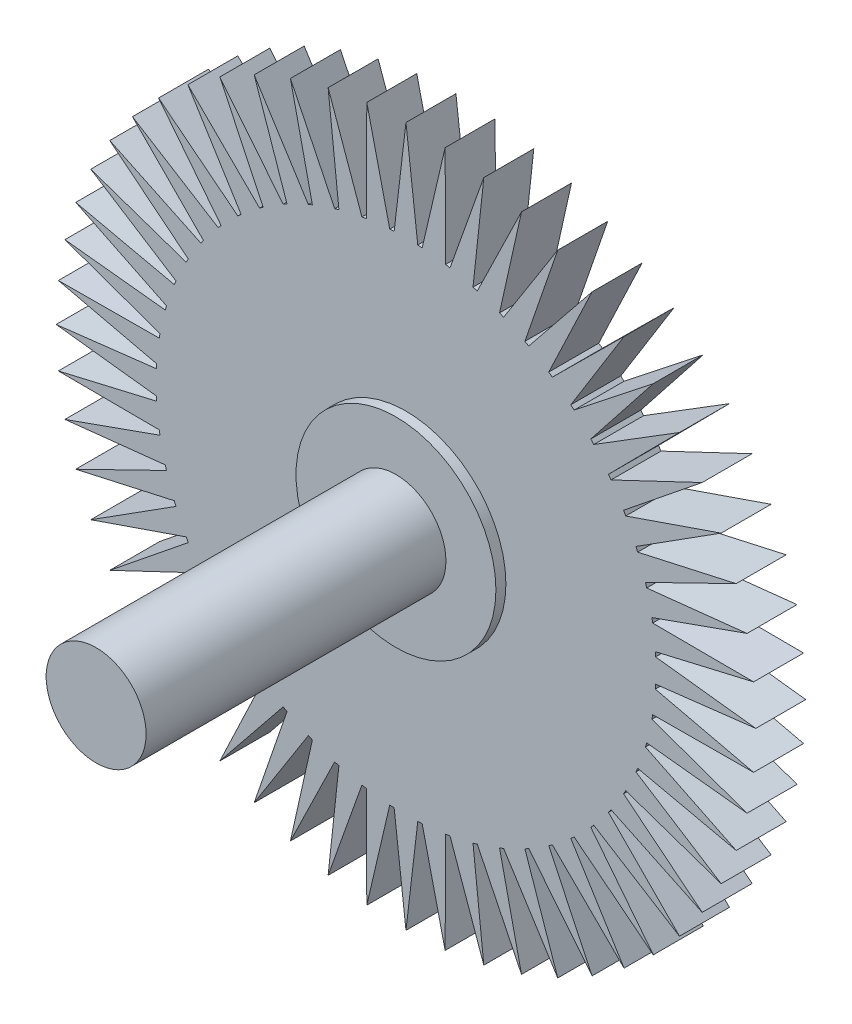
from build123d import *

# Parameters (mm, degrees)
ESQUISSE1_R             = 35
BOSS_EXTRU_1_DEPTH      = 5
ENL_V_START             = -5
ENL_V_MAT_EXTRU_2_DEPTH = 5
ESQUISSE5_R             = 10
BOSS_EXTRU_2_DEPTH      = 1
ESQUISSE6_R             = 5
BOSS_EXTRU_3_DEPTH      = 30


with BuildPart() as part:
    # Esquisse1 → Boss.-Extru.1 (new body)
    with BuildSketch(Plane.XY):
        Circle(ESQUISSE1_R)
    extrude(amount=BOSS_EXTRU_1_DEPTH)

    # Esquisse3 → Enlèv. mat.-Extru.2 (cut)
    with BuildSketch(Plane.XY.offset(5).offset(ENL_V_START)):
        with BuildLine():
            Line((-11.898891299, 21.986732041), (-15.185930869, 31.533910377))
            ThreePointArc((-15.185930869, 31.533910377), (-16.930161049, 30.632819767), (-18.621122678, 29.635346973))
            Line((-18.621122678, 29.635346973), (-12.286106235, 21.77272591))
            ThreePointArc((-12.286106235, 21.77272591), (-12.092972178, 21.880585548), (-11.898891299, 21.986732041))
        make_face()
        with BuildLine():
            Line((-9.362340634, 23.180737216), (-11.559767168, 33.035916561))
            ThreePointArc((-11.559767168, 33.035916561), (-13.393920133, 32.335783638), (-15.185930869, 31.533910377))
            Line((-15.185930869, 31.533910377), (-9.771081928, 23.011431028))
            ThreePointArc((-9.771081928, 23.011431028), (-9.567085809, 23.096988313), (-9.362340634, 23.180737216))
        make_face()
        with BuildLine():
            Line((-6.708053103, 24.08323117), (-7.788232688, 34.122476926))
            ThreePointArc((-7.788232688, 34.122476926), (-9.6892429, 33.632106268), (-11.559767168, 33.035916561))
            Line((-11.559767168, 33.035916561), (-7.133180597, 23.960754049))
            ThreePointArc((-7.133180597, 23.960754049), (-6.920887786, 24.022933049), (-6.708053103, 24.08323117))
        make_face()
        with BuildLine():
            Line((-3.969407912, 24.682864518), (-3.918756664, 34.779927346))
            ThreePointArc((-3.918756664, 34.779927346), (-5.862717816, 34.505485648), (-7.788232688, 34.122476926))
            Line((-7.788232688, 34.122476926), (-4.40557538, 24.608756685))
            ThreePointArc((-4.40557538, 24.608756685), (-4.187655583, 24.646775463), (-3.969407912, 24.682864518))
        make_face()
        with BuildLine():
            Line((-1.180845114, 24.972096524), (0, 35))
            ThreePointArc((0, 35), (-1.962465653, 34.944938526), (-3.918756664, 34.779927346))
            Line((-3.918756664, 34.779927346), (-1.622567497, 24.947289927))
            ThreePointArc((-1.622567497, 24.947289927), (-1.401761181, 24.960670375), (-1.180845114, 24.972096524))
        make_face()
        with BuildLine():
            ThreePointArc((3.918756664, 34.779927346), (1.962465653, 34.944938526), (0, 35))
            Line((0, 35), (1.180845114, 24.972096524))
            ThreePointArc((1.180845114, 24.972096524), (1.401761181, 24.960670375), (1.622567497, 24.947289927))
            Line((1.622567497, 24.947289927), (3.918756664, 34.779927346))
        make_face()
        with BuildLine():
            ThreePointArc((7.788232688, 34.122476926), (5.862717816, 34.505485648), (3.918756664, 34.779927346))
            Line((3.918756664, 34.779927346), (3.969407912, 24.682864518))
            ThreePointArc((3.969407912, 24.682864518), (4.187655583, 24.646775463), (4.40557538, 24.608756685))
            Line((4.40557538, 24.608756685), (7.788232688, 34.122476926))
        make_face()
        with BuildLine():
            ThreePointArc((11.559767168, 33.035916561), (9.6892429, 33.632106268), (7.788232688, 34.122476926))
            Line((7.788232688, 34.122476926), (6.708053103, 24.08323117))
            ThreePointArc((6.708053103, 24.08323117), (6.920887786, 24.022933049), (7.133180597, 23.960754049))
            Line((7.133180597, 23.960754049), (11.559767168, 33.035916561))
        make_face()
        with BuildLine():
            ThreePointArc((15.185930869, 31.533910377), (13.393920133, 32.335783638), (11.559767168, 33.035916561))
            Line((11.559767168, 33.035916561), (9.362340634, 23.180737216))
            ThreePointArc((9.362340634, 23.180737216), (9.567085809, 23.096988313), (9.771081928, 23.011431028))
            Line((9.771081928, 23.011431028), (15.185930869, 31.533910377))
        make_face()
        with BuildLine():
            ThreePointArc((18.621122678, 29.635346973), (16.930161049, 30.632819767), (15.185930869, 31.533910377))
            Line((15.185930869, 31.533910377), (11.898891299, 21.986732041))
            ThreePointArc((11.898891299, 21.986732041), (12.092972178, 21.880585548), (12.286106235, 21.77272591))
            Line((12.286106235, 21.77272591), (18.621122678, 29.635346973))
        make_face()
        with BuildLine():
            ThreePointArc((21.822143065, 27.364101886), (20.253495366, 28.544630414), (18.621122678, 29.635346973))
            Line((18.621122678, 29.635346973), (14.285806502, 20.516230955))
            ThreePointArc((14.285806502, 20.516230955), (14.466782404, 20.389021724), (14.646625628, 20.260216132))
            Line((14.646625628, 20.260216132), (21.822143065, 27.364101886))
        make_face()
        with BuildLine():
            ThreePointArc((24.748737342, 24.748737342), (23.322130228, 26.097475771), (21.822143065, 27.364101886))
            Line((21.822143065, 27.364101886), (16.4930694, 18.78772636))
            ThreePointArc((16.4930694, 18.78772636), (16.658664449, 18.641054122), (16.822955205, 18.49292238))
            Line((16.822955205, 18.49292238), (24.748737342, 24.748737342))
        make_face()
        with BuildLine():
            Line((-14.285806502, 20.516230955), (-18.621122678, 29.635346973))
            ThreePointArc((-18.621122678, 29.635346973), (-20.253495366, 28.544630414), (-21.822143065, 27.364101886))
            Line((-21.822143065, 27.364101886), (-14.646625628, 20.260216132))
            ThreePointArc((-14.646625628, 20.260216132), (-14.466782404, 20.389021724), (-14.285806502, 20.516230955))
        make_face()
        with BuildLine():
            Line((-16.4930694, 18.78772636), (-21.822143065, 27.364101886))
            ThreePointArc((-21.822143065, 27.364101886), (-23.322130228, 26.097475771), (-24.748737342, 24.748737342))
            Line((-24.748737342, 24.748737342), (-16.822955205, 18.49292238))
            ThreePointArc((-16.822955205, 18.49292238), (-16.658664449, 18.641054122), (-16.4930694, 18.78772636))
        make_face()
        with BuildLine():
            Line((-18.49292238, 16.822955205), (-24.748737342, 24.748737342))
            ThreePointArc((-24.748737342, 24.748737342), (-26.097475771, 23.322130228), (-27.364101886, 21.822143065))
            Line((-27.364101886, 21.822143065), (-18.78772636, 16.4930694))
            ThreePointArc((-18.78772636, 16.4930694), (-18.641054122, 16.658664449), (-18.49292238, 16.822955205))
        make_face()
        with BuildLine():
            Line((-20.260216132, 14.646625628), (-27.364101886, 21.822143065))
            ThreePointArc((-27.364101886, 21.822143065), (-28.544630414, 20.253495366), (-29.635346973, 18.621122678))
            Line((-29.635346973, 18.621122678), (-20.516230955, 14.285806502))
            ThreePointArc((-20.516230955, 14.285806502), (-20.389021724, 14.466782404), (-20.260216132, 14.646625628))
        make_face()
        with BuildLine():
            Line((-21.77272591, 12.286106235), (-29.635346973, 18.621122678))
            ThreePointArc((-29.635346973, 18.621122678), (-30.632819767, 16.930161049), (-31.533910377, 15.185930869))
            Line((-31.533910377, 15.185930869), (-21.986732041, 11.898891299))
            ThreePointArc((-21.986732041, 11.898891299), (-21.880585548, 12.092972178), (-21.77272591, 12.286106235))
        make_face()
        with BuildLine():
            Line((-23.011431028, 9.771081928), (-31.533910377, 15.185930869))
            ThreePointArc((-31.533910377, 15.185930869), (-32.335783638, 13.393920133), (-33.035916561, 11.559767168))
            Line((-33.035916561, 11.559767168), (-23.180737216, 9.362340634))
            ThreePointArc((-23.180737216, 9.362340634), (-23.096988313, 9.567085809), (-23.011431028, 9.771081928))
        make_face()
        with BuildLine():
            Line((-23.960754049, 7.133180597), (-33.035916561, 11.559767168))
            ThreePointArc((-33.035916561, 11.559767168), (-33.632106268, 9.6892429), (-34.122476926, 7.788232688))
            Line((-34.122476926, 7.788232688), (-24.08323117, 6.708053103))
            ThreePointArc((-24.08323117, 6.708053103), (-24.022933049, 6.920887786), (-23.960754049, 7.133180597))
        make_face()
        with BuildLine():
            Line((-24.608756685, 4.40557538), (-34.122476926, 7.788232688))
            ThreePointArc((-34.122476926, 7.788232688), (-34.505485648, 5.862717816), (-34.779927346, 3.918756664))
            Line((-34.779927346, 3.918756664), (-24.682864518, 3.969407912))
            ThreePointArc((-24.682864518, 3.969407912), (-24.646775463, 4.187655583), (-24.608756685, 4.40557538))
        make_face()
        with BuildLine():
            Line((-24.947289927, 1.622567497), (-34.779927346, 3.918756664))
            ThreePointArc((-34.779927346, 3.918756664), (-34.944938526, 1.962465653), (-35, 0))
            Line((-35, 0), (-24.972096524, 1.180845114))
            ThreePointArc((-24.972096524, 1.180845114), (-24.960670375, 1.401761181), (-24.947289927, 1.622567497))
        make_face()
        with BuildLine():
            Line((-24.972096524, -1.180845114), (-35, 0))
            ThreePointArc((-35, 0), (-34.944938526, -1.962465653), (-34.779927346, -3.918756664))
            Line((-34.779927346, -3.918756664), (-24.947289927, -1.622567497))
            ThreePointArc((-24.947289927, -1.622567497), (-24.960670375, -1.401761181), (-24.972096524, -1.180845114))
        make_face()
        with BuildLine():
            Line((-24.682864518, -3.969407912), (-34.779927346, -3.918756664))
            ThreePointArc((-34.779927346, -3.918756664), (-34.505485648, -5.862717816), (-34.122476926, -7.788232688))
            Line((-34.122476926, -7.788232688), (-24.608756685, -4.40557538))
            ThreePointArc((-24.608756685, -4.40557538), (-24.646775463, -4.187655583), (-24.682864518, -3.969407912))
        make_face()
        with BuildLine():
            Line((-24.08323117, -6.708053103), (-34.122476926, -7.788232688))
            ThreePointArc((-34.122476926, -7.788232688), (-33.632106268, -9.6892429), (-33.035916561, -11.559767168))
            Line((-33.035916561, -11.559767168), (-23.960754049, -7.133180597))
            ThreePointArc((-23.960754049, -7.133180597), (-24.022933049, -6.920887786), (-24.08323117, -6.708053103))
        make_face()
        with BuildLine():
            Line((-23.180737216, -9.362340634), (-33.035916561, -11.559767168))
            ThreePointArc((-33.035916561, -11.559767168), (-32.335783638, -13.393920133), (-31.533910377, -15.185930869))
            Line((-31.533910377, -15.185930869), (-23.011431028, -9.771081928))
            ThreePointArc((-23.011431028, -9.771081928), (-23.096988313, -9.567085809), (-23.180737216, -9.362340634))
        make_face()
        with BuildLine():
            Line((-21.986732041, -11.898891299), (-31.533910377, -15.185930869))
            ThreePointArc((-31.533910377, -15.185930869), (-30.632819767, -16.930161049), (-29.635346973, -18.621122678))
            Line((-29.635346973, -18.621122678), (-21.77272591, -12.286106235))
            ThreePointArc((-21.77272591, -12.286106235), (-21.880585548, -12.092972178), (-21.986732041, -11.898891299))
        make_face()
        with BuildLine():
            Line((-20.516230955, -14.285806502), (-29.635346973, -18.621122678))
            ThreePointArc((-29.635346973, -18.621122678), (-28.544630414, -20.253495366), (-27.364101886, -21.822143065))
            Line((-27.364101886, -21.822143065), (-20.260216132, -14.646625628))
            ThreePointArc((-20.260216132, -14.646625628), (-20.389021724, -14.466782404), (-20.516230955, -14.285806502))
        make_face()
        with BuildLine():
            Line((-18.78772636, -16.4930694), (-27.364101886, -21.822143065))
            ThreePointArc((-27.364101886, -21.822143065), (-26.097475771, -23.322130228), (-24.748737342, -24.748737342))
            Line((-24.748737342, -24.748737342), (-18.49292238, -16.822955205))
            ThreePointArc((-18.49292238, -16.822955205), (-18.641054122, -16.658664449), (-18.78772636, -16.4930694))
        make_face()
        with BuildLine():
            Line((-16.822955205, -18.49292238), (-24.748737342, -24.748737342))
            ThreePointArc((-24.748737342, -24.748737342), (-23.322130228, -26.097475771), (-21.822143065, -27.364101886))
            Line((-21.822143065, -27.364101886), (-16.4930694, -18.78772636))
            ThreePointArc((-16.4930694, -18.78772636), (-16.658664449, -18.641054122), (-16.822955205, -18.49292238))
        make_face()
        with BuildLine():
            Line((-14.646625628, -20.260216132), (-21.822143065, -27.364101886))
            ThreePointArc((-21.822143065, -27.364101886), (-20.253495366, -28.544630414), (-18.621122678, -29.635346973))
            Line((-18.621122678, -29.635346973), (-14.285806502, -20.516230955))
            ThreePointArc((-14.285806502, -20.516230955), (-14.466782404, -20.389021724), (-14.646625628, -20.260216132))
        make_face()
        with BuildLine():
            Line((-12.286106235, -21.77272591), (-18.621122678, -29.635346973))
            ThreePointArc((-18.621122678, -29.635346973), (-16.930161049, -30.632819767), (-15.185930869, -31.533910377))
            Line((-15.185930869, -31.533910377), (-11.898891299, -21.986732041))
            ThreePointArc((-11.898891299, -21.986732041), (-12.092972178, -21.880585548), (-12.286106235, -21.77272591))
        make_face()
        with BuildLine():
            Line((-9.771081928, -23.011431028), (-15.185930869, -31.533910377))
            ThreePointArc((-15.185930869, -31.533910377), (-13.393920133, -32.335783638), (-11.559767168, -33.035916561))
            Line((-11.559767168, -33.035916561), (-9.362340634, -23.180737216))
            ThreePointArc((-9.362340634, -23.180737216), (-9.567085809, -23.096988313), (-9.771081928, -23.011431028))
        make_face()
        with BuildLine():
            Line((-7.133180597, -23.960754049), (-11.559767168, -33.035916561))
            ThreePointArc((-11.559767168, -33.035916561), (-9.6892429, -33.632106268), (-7.788232688, -34.122476926))
            Line((-7.788232688, -34.122476926), (-6.708053103, -24.08323117))
            ThreePointArc((-6.708053103, -24.08323117), (-6.920887786, -24.022933049), (-7.133180597, -23.960754049))
        make_face()
        with BuildLine():
            Line((-4.40557538, -24.608756685), (-7.788232688, -34.122476926))
            ThreePointArc((-7.788232688, -34.122476926), (-5.862717816, -34.505485648), (-3.918756664, -34.779927346))
            Line((-3.918756664, -34.779927346), (-3.969407912, -24.682864518))
            ThreePointArc((-3.969407912, -24.682864518), (-4.187655583, -24.646775463), (-4.40557538, -24.608756685))
        make_face()
        with BuildLine():
            Line((-1.622567497, -24.947289927), (-3.918756664, -34.779927346))
            ThreePointArc((-3.918756664, -34.779927346), (-1.962465653, -34.944938526), (0, -35))
            Line((0, -35), (-1.180845114, -24.972096524))
            ThreePointArc((-1.180845114, -24.972096524), (-1.401761181, -24.960670375), (-1.622567497, -24.947289927))
        make_face()
        with BuildLine():
            ThreePointArc((0, -35), (1.962465653, -34.944938526), (3.918756664, -34.779927346))
            Line((3.918756664, -34.779927346), (1.622567497, -24.947289927))
            ThreePointArc((1.622567497, -24.947289927), (1.401761181, -24.960670375), (1.180845114, -24.972096524))
            Line((1.180845114, -24.972096524), (0, -35))
        make_face()
        with BuildLine():
            ThreePointArc((3.918756664, -34.779927346), (5.862717816, -34.505485648), (7.788232688, -34.122476926))
            Line((7.788232688, -34.122476926), (4.40557538, -24.608756685))
            ThreePointArc((4.40557538, -24.608756685), (4.187655583, -24.646775463), (3.969407912, -24.682864518))
            Line((3.969407912, -24.682864518), (3.918756664, -34.779927346))
        make_face()
        with BuildLine():
            ThreePointArc((7.788232688, -34.122476926), (9.6892429, -33.632106268), (11.559767168, -33.035916561))
            Line((11.559767168, -33.035916561), (7.133180597, -23.960754049))
            ThreePointArc((7.133180597, -23.960754049), (6.920887786, -24.022933049), (6.708053103, -24.08323117))
            Line((6.708053103, -24.08323117), (7.788232688, -34.122476926))
        make_face()
        with BuildLine():
            ThreePointArc((11.559767168, -33.035916561), (13.393920133, -32.335783638), (15.185930869, -31.533910377))
            Line((15.185930869, -31.533910377), (9.771081928, -23.011431028))
            ThreePointArc((9.771081928, -23.011431028), (9.567085809, -23.096988313), (9.362340634, -23.180737216))
            Line((9.362340634, -23.180737216), (11.559767168, -33.035916561))
        make_face()
        with BuildLine():
            ThreePointArc((15.185930869, -31.533910377), (16.930161049, -30.632819767), (18.621122678, -29.635346973))
            Line((18.621122678, -29.635346973), (12.286106235, -21.77272591))
            ThreePointArc((12.286106235, -21.77272591), (12.092972178, -21.880585548), (11.898891299, -21.986732041))
            Line((11.898891299, -21.986732041), (15.185930869, -31.533910377))
        make_face()
        with BuildLine():
            ThreePointArc((18.621122678, -29.635346973), (20.253495366, -28.544630414), (21.822143065, -27.364101886))
            Line((21.822143065, -27.364101886), (14.646625628, -20.260216132))
            ThreePointArc((14.646625628, -20.260216132), (14.466782404, -20.389021724), (14.285806502, -20.516230955))
            Line((14.285806502, -20.516230955), (18.621122678, -29.635346973))
        make_face()
        with BuildLine():
            ThreePointArc((21.822143065, -27.364101886), (23.322130228, -26.097475771), (24.748737342, -24.748737342))
            Line((24.748737342, -24.748737342), (16.822955205, -18.49292238))
            ThreePointArc((16.822955205, -18.49292238), (16.658664449, -18.641054122), (16.4930694, -18.78772636))
            Line((16.4930694, -18.78772636), (21.822143065, -27.364101886))
        make_face()
        with BuildLine():
            ThreePointArc((24.748737342, -24.748737342), (26.097475771, -23.322130228), (27.364101886, -21.822143065))
            Line((27.364101886, -21.822143065), (18.78772636, -16.4930694))
            ThreePointArc((18.78772636, -16.4930694), (18.641054122, -16.658664449), (18.49292238, -16.822955205))
            Line((18.49292238, -16.822955205), (24.748737342, -24.748737342))
        make_face()
        with BuildLine():
            ThreePointArc((27.364101886, -21.822143065), (28.544630414, -20.253495366), (29.635346973, -18.621122678))
            Line((29.635346973, -18.621122678), (20.516230955, -14.285806502))
            ThreePointArc((20.516230955, -14.285806502), (20.389021724, -14.466782404), (20.260216132, -14.646625628))
            Line((20.260216132, -14.646625628), (27.364101886, -21.822143065))
        make_face()
        with BuildLine():
            ThreePointArc((29.635346973, -18.621122678), (30.632819767, -16.930161049), (31.533910377, -15.185930869))
            Line((31.533910377, -15.185930869), (21.986732041, -11.898891299))
            ThreePointArc((21.986732041, -11.898891299), (21.880585548, -12.092972178), (21.77272591, -12.286106235))
            Line((21.77272591, -12.286106235), (29.635346973, -18.621122678))
        make_face()
        with BuildLine():
            ThreePointArc((31.533910377, -15.185930869), (32.335783638, -13.393920133), (33.035916561, -11.559767168))
            Line((33.035916561, -11.559767168), (23.180737216, -9.362340634))
            ThreePointArc((23.180737216, -9.362340634), (23.096988313, -9.567085809), (23.011431028, -9.771081928))
            Line((23.011431028, -9.771081928), (31.533910377, -15.185930869))
        make_face()
        with BuildLine():
            ThreePointArc((33.035916561, -11.559767168), (33.632106268, -9.6892429), (34.122476926, -7.788232688))
            Line((34.122476926, -7.788232688), (24.08323117, -6.708053103))
            ThreePointArc((24.08323117, -6.708053103), (24.022933049, -6.920887786), (23.960754049, -7.133180597))
            Line((23.960754049, -7.133180597), (33.035916561, -11.559767168))
        make_face()
        with BuildLine():
            ThreePointArc((34.122476926, -7.788232688), (34.505485648, -5.862717816), (34.779927346, -3.918756664))
            Line((34.779927346, -3.918756664), (24.682864518, -3.969407912))
            ThreePointArc((24.682864518, -3.969407912), (24.646775463, -4.187655583), (24.608756685, -4.40557538))
            Line((24.608756685, -4.40557538), (34.122476926, -7.788232688))
        make_face()
        with BuildLine():
            ThreePointArc((27.364101886, 21.822143065), (26.097475771, 23.322130228), (24.748737342, 24.748737342))
            Line((24.748737342, 24.748737342), (18.49292238, 16.822955205))
            ThreePointArc((18.49292238, 16.822955205), (18.641054122, 16.658664449), (18.78772636, 16.4930694))
            Line((18.78772636, 16.4930694), (27.364101886, 21.822143065))
        make_face()
        with BuildLine():
            ThreePointArc((29.635346973, 18.621122678), (28.544630414, 20.253495366), (27.364101886, 21.822143065))
            Line((27.364101886, 21.822143065), (20.260216132, 14.646625628))
            ThreePointArc((20.260216132, 14.646625628), (20.389021724, 14.466782404), (20.516230955, 14.285806502))
            Line((20.516230955, 14.285806502), (29.635346973, 18.621122678))
        make_face()
        with BuildLine():
            ThreePointArc((31.533910377, 15.185930869), (30.632819767, 16.930161049), (29.635346973, 18.621122678))
            Line((29.635346973, 18.621122678), (21.77272591, 12.286106235))
            ThreePointArc((21.77272591, 12.286106235), (21.880585548, 12.092972178), (21.986732041, 11.898891299))
            Line((21.986732041, 11.898891299), (31.533910377, 15.185930869))
        make_face()
        with BuildLine():
            ThreePointArc((33.035916561, 11.559767168), (32.335783638, 13.393920133), (31.533910377, 15.185930869))
            Line((31.533910377, 15.185930869), (23.011431028, 9.771081928))
            ThreePointArc((23.011431028, 9.771081928), (23.096988313, 9.567085809), (23.180737216, 9.362340634))
            Line((23.180737216, 9.362340634), (33.035916561, 11.559767168))
        make_face()
        with BuildLine():
            ThreePointArc((34.122476926, 7.788232688), (33.632106268, 9.6892429), (33.035916561, 11.559767168))
            Line((33.035916561, 11.559767168), (23.960754049, 7.133180597))
            ThreePointArc((23.960754049, 7.133180597), (24.022933049, 6.920887786), (24.08323117, 6.708053103))
            Line((24.08323117, 6.708053103), (34.122476926, 7.788232688))
        make_face()
        with BuildLine():
            ThreePointArc((34.779927346, 3.918756664), (34.505485648, 5.862717816), (34.122476926, 7.788232688))
            Line((34.122476926, 7.788232688), (24.608756685, 4.40557538))
            ThreePointArc((24.608756685, 4.40557538), (24.646775463, 4.187655583), (24.682864518, 3.969407912))
            Line((24.682864518, 3.969407912), (34.779927346, 3.918756664))
        make_face()
        with BuildLine():
            ThreePointArc((35, 0), (34.944938526, 1.962465653), (34.779927346, 3.918756664))
            Line((34.779927346, 3.918756664), (24.947289927, 1.622567497))
            ThreePointArc((24.947289927, 1.622567497), (24.960670375, 1.401761181), (24.972096524, 1.180845114))
            Line((24.972096524, 1.180845114), (35, 0))
        make_face()
        with BuildLine():
            ThreePointArc((34.779927346, -3.918756664), (34.944938526, -1.962465653), (35, 0))
            Line((35, 0), (24.972096524, -1.180845114))
            ThreePointArc((24.972096524, -1.180845114), (24.960670375, -1.401761181), (24.947289927, -1.622567497))
            Line((24.947289927, -1.622567497), (34.779927346, -3.918756664))
        make_face()
    extrude(amount=ENL_V_MAT_EXTRU_2_DEPTH, mode=Mode.SUBTRACT)

    # Esquisse5 → Boss.-Extru.2 (add)
    with BuildSketch(Plane.XY.offset(5)):
        Circle(ESQUISSE5_R)
    extrude(amount=BOSS_EXTRU_2_DEPTH)

    # Esquisse6 → Boss.-Extru.3 (add)
    with BuildSketch(Plane.XY.offset(6)):
        Circle(ESQUISSE6_R)
    extrude(amount=BOSS_EXTRU_3_DEPTH)


solid = part.part
